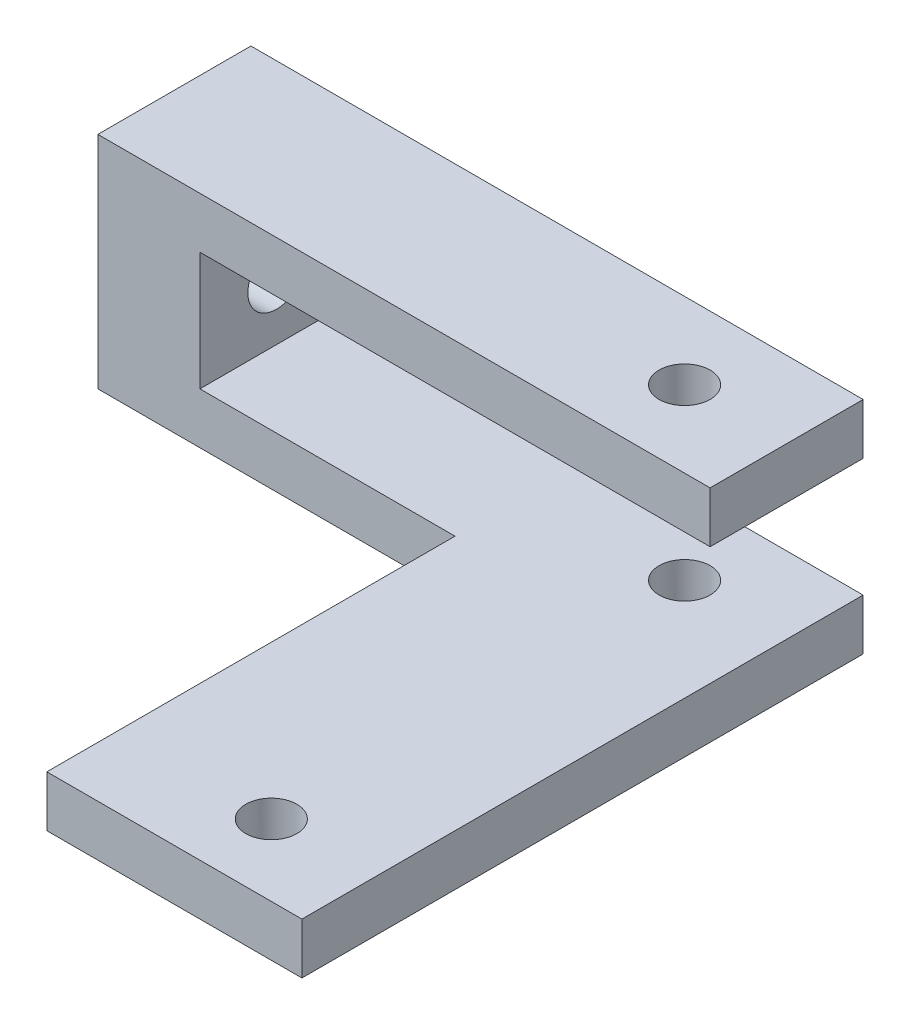
from build123d import *

# Parameters (mm, degrees)
BOSS_EXTRUDE1_DEPTH     = 19.05
SKETCH2_W               = 31.75
SKETCH2_H               = 6.35
BOSS_EXTRUDE2_DEPTH     = 50.8
CUT_EXTRUDE1_DEPTH      = 106.498403893
CUT_EXTRUDE1_DEPTH_BACK = 106.498403893
SKETCH3_R               = 3.175
SKETCH4_R               = 3.556
CUT_EXTRUDE2_DEPTH      = 50.8


with BuildPart() as part:
    # Sketch1 → Boss-Extrude1 (new body)
    with BuildSketch(Plane.XY):
        Polygon((0, 0), (76.2, 0), (76.2, -6.35), (12.7, -6.35), (12.7, -21.082), (76.2, -21.082), (76.2, -27.432), (0, -27.432), align=None)
    extrude(amount=BOSS_EXTRUDE1_DEPTH)

    # Sketch2 → Boss-Extrude2 (add)
    with BuildSketch(Plane.XY.offset(19.05)):
        with Locations((60.325, -24.257)):
            Rectangle(SKETCH2_W, SKETCH2_H)
    extrude(amount=BOSS_EXTRUDE2_DEPTH)

    # Sketch3 → Cut-Extrude1 (cut, two sides: drawn at the far end of the back side and taken through both)
    with BuildSketch(Plane(origin=(0, -21.082, 0), x_dir=(1, 0, 0), z_dir=(0, 1, 0)).offset(-CUT_EXTRUDE1_DEPTH_BACK)):
        with Locations(Location((63.5, -60.96, 0), (0, 0, 270))):
            Circle(SKETCH3_R)
        with Locations(Location((63.5, -9.525, 0), (0, 0, 270))):
            Circle(SKETCH3_R)
    extrude(amount=CUT_EXTRUDE1_DEPTH + CUT_EXTRUDE1_DEPTH_BACK, mode=Mode.SUBTRACT)

    # Sketch4 → Cut-Extrude2 (cut)
    with BuildSketch(Plane.ZY):
        with Locations((9.525, -13.716)):
            Circle(SKETCH4_R)
    extrude(amount=-CUT_EXTRUDE2_DEPTH, mode=Mode.SUBTRACT)


solid = part.part
